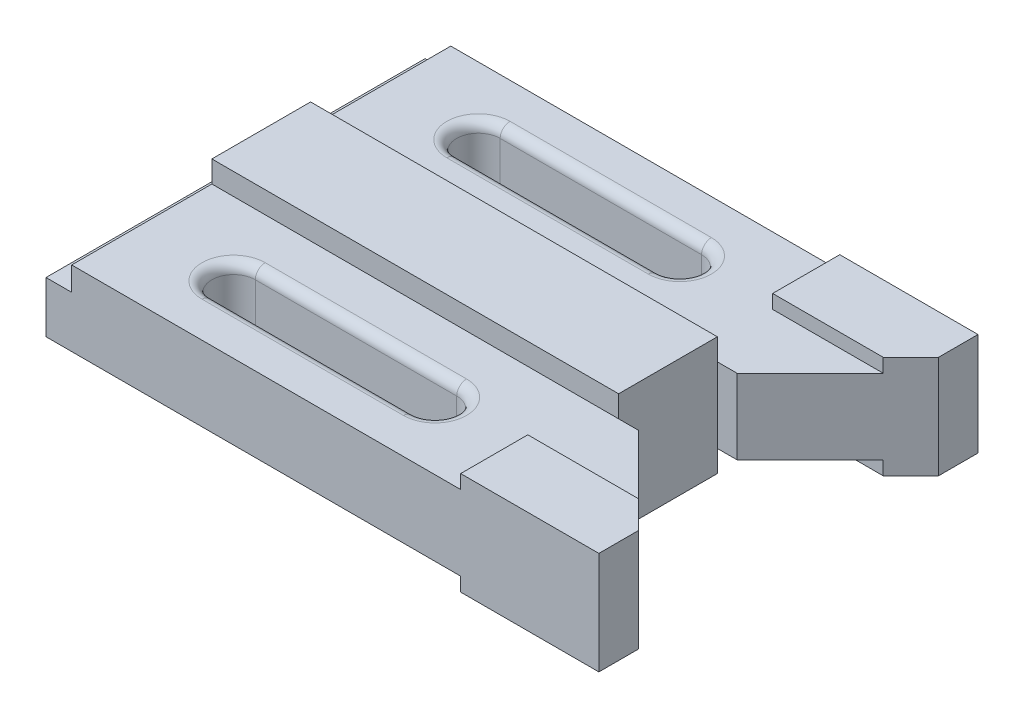
from build123d import *

# Parameters (mm, degrees)
SKETCH1_W             = 109.5
SKETCH1_H             = 25
BOSS_EXTRUDE1_DEPTH   = 15
BOSS_EXTRUDE2_DEPTH   = 9.5
BOSS_EXTRUDE2_2_DEPTH = 9.5
BOSS_EXTRUDE3_DEPTH   = 13
FILLET1_R             = 2.5
FILLET2_R             = 2.5
FILLET3_R             = 2.5
FILLET4_R             = 2.5
SKETCH2_W             = 6.5
SKETCH2_H             = 96
CUT_EXTRUDE1_DEPTH    = 11.5


with BuildPart() as part:
    # Sketch1 → Boss-Extrude1 (new, symmetric)
    with BuildSketch(Plane(origin=(0, 0, 0), x_dir=(1, 0, 0), z_dir=(0, 1, 0))):
        with Locations((54.75, 0)):
            Rectangle(SKETCH1_W, SKETCH1_H)
    extrude(amount=BOSS_EXTRUDE1_DEPTH, both=True)


with BuildPart() as body_2:
    # Sketch1<3> → Boss-Extrude2 (new, symmetric)
    with BuildSketch(Plane(origin=(0, 0, 0), x_dir=(1, 0, 0), z_dir=(0, 1, 0))):
        Polygon((105, 48), (0, 48), (0, 12.5), (114.5, 12.5), (133, 31), (105, 31), align=None)
        with BuildLine():
            Line((81.5, 25.5), (30.5, 25.5))
            ThreePointArc((30.5, 25.5), (25, 31), (30.5, 36.5))
            Line((30.5, 36.5), (81.5, 36.5))
            ThreePointArc((81.5, 36.5), (87, 31), (81.5, 25.5))
        make_face(mode=Mode.SUBTRACT)
    extrude(amount=BOSS_EXTRUDE2_DEPTH, both=True)



with BuildPart() as body_3:
    # Sketch1<3> → Boss-Extrude2 2 (new, symmetric)
    with BuildSketch(Plane(origin=(0, 0, 0), x_dir=(1, 0, 0), z_dir=(0, 1, 0))):
        Polygon((114.5, -12.5), (0, -12.5), (0, -48), (105, -48), (105, -31), (133, -31), align=None)
        with BuildLine():
            ThreePointArc((30.5, -36.5), (25, -31), (30.5, -25.5))
            Line((30.5, -25.5), (81.5, -25.5))
            ThreePointArc((81.5, -25.5), (87, -31), (81.5, -36.5))
            Line((81.5, -36.5), (30.5, -36.5))
        make_face(mode=Mode.SUBTRACT)
    extrude(amount=BOSS_EXTRUDE2_2_DEPTH, both=True)


with BuildPart() as body_2_1:
    add(body_2.part)

    add(body_3.part)  # Boss-Extrude3 merges body 3
    # Sketch1<4> → Boss-Extrude3 (add, symmetric)
    with BuildSketch(Plane(origin=(0, 0, 0), x_dir=(1, 0, 0), z_dir=(0, 1, 0))):
        Polygon((140, 48), (105, 48), (105, 31), (133, 31), (140, 38), align=None)
        Polygon((105, -31), (105, -48), (140, -48), (140, -38), (133, -31), align=None)
    extrude(amount=BOSS_EXTRUDE3_DEPTH, both=True)

    # Fillet1
    fillet1_edges = [body_2_1.edges().sort_by_distance(p)[0] for p in [
        (25, 9.5, -31),
        (87, 9.5, -31),
        (56, 9.5, -25.5),
        (56, 9.5, -36.5),
    ]]
    fillet(fillet1_edges, radius=FILLET1_R)

    # Fillet2
    fillet2_edges = [body_2_1.edges().sort_by_distance(p)[0] for p in [
        (25, 9.5, 31),
        (87, 9.5, 31),
        (56, 9.5, 36.5),
        (56, 9.5, 25.5),
    ]]
    fillet(fillet2_edges, radius=FILLET2_R)

    # Fillet3
    fillet3_edges = [body_2_1.edges().sort_by_distance(p)[0] for p in [
        (87, -9.5, -31),
        (25, -9.5, -31),
        (56, -9.5, -25.5),
        (56, -9.5, -36.5),
    ]]
    fillet(fillet3_edges, radius=FILLET3_R)

    # Fillet4
    fillet4_edges = [body_2_1.edges().sort_by_distance(p)[0] for p in [
        (87, -9.5, 31),
        (25, -9.5, 31),
        (56, -9.5, 36.5),
        (56, -9.5, 25.5),
    ]]
    fillet(fillet4_edges, radius=FILLET4_R)


with BuildPart() as cut_extrude1_tool:
    # Sketch2 → Cut-Extrude1 (new body)
    with BuildSketch(Plane(origin=(0, 15, 0), x_dir=(1, 0, 0), z_dir=(0, 1, 0))):
        with Locations((3.25, 0)):
            Rectangle(SKETCH2_W, SKETCH2_H)
    extrude(amount=-CUT_EXTRUDE1_DEPTH)


with BuildPart() as part_1:
    add(part.part)

    # Cut-Extrude1: cut by cut_extrude1_tool
    add(cut_extrude1_tool.part, mode=Mode.SUBTRACT)


with BuildPart() as body_2_2:
    add(body_2_1.part)

    # Cut-Extrude1: cut by cut_extrude1_tool
    add(cut_extrude1_tool.part, mode=Mode.SUBTRACT)


solid = Compound([part_1.part, body_2_2.part])
